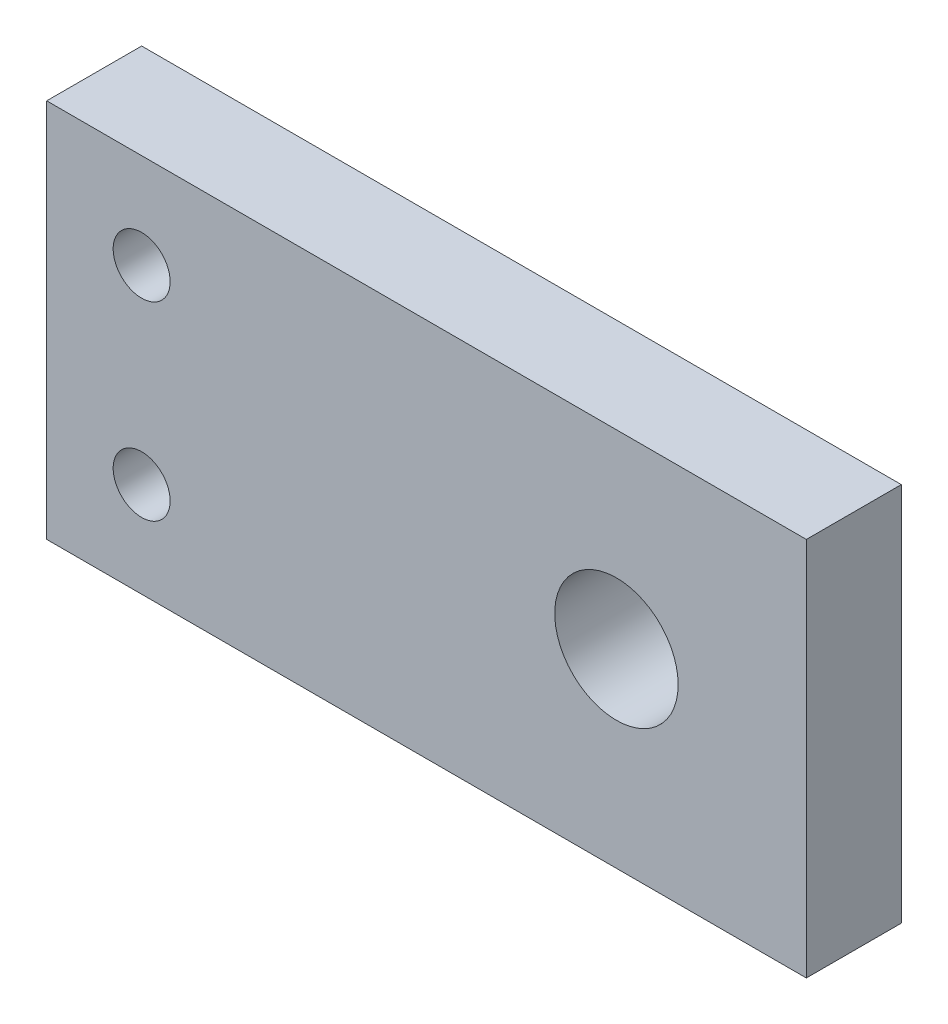
from build123d import *

# Parameters (mm, degrees)
SKETCH1_W           = 40
SKETCH1_H           = 20
BOSS_EXTRUDE1_DEPTH = 5
SKETCH2_R           = 3.25
SKETCH2_R_2         = 1.5
CUT_EXTRUDE1_DEPTH  = 5


with BuildPart() as part:
    # Sketch1 → Boss-Extrude1 (new body)
    with BuildSketch(Plane.XY):
        with Locations((20, 10)):
            Rectangle(SKETCH1_W, SKETCH1_H)
    extrude(amount=BOSS_EXTRUDE1_DEPTH)

    # Sketch2 → Cut-Extrude1 (cut)
    with BuildSketch(Plane.XY.offset(5)):
        with Locations((30, 10)):
            Circle(SKETCH2_R)
        with Locations((5, 15)):
            Circle(SKETCH2_R_2)
        with Locations((5, 5)):
            Circle(SKETCH2_R_2)
    extrude(amount=-CUT_EXTRUDE1_DEPTH, mode=Mode.SUBTRACT)


solid = part.part
